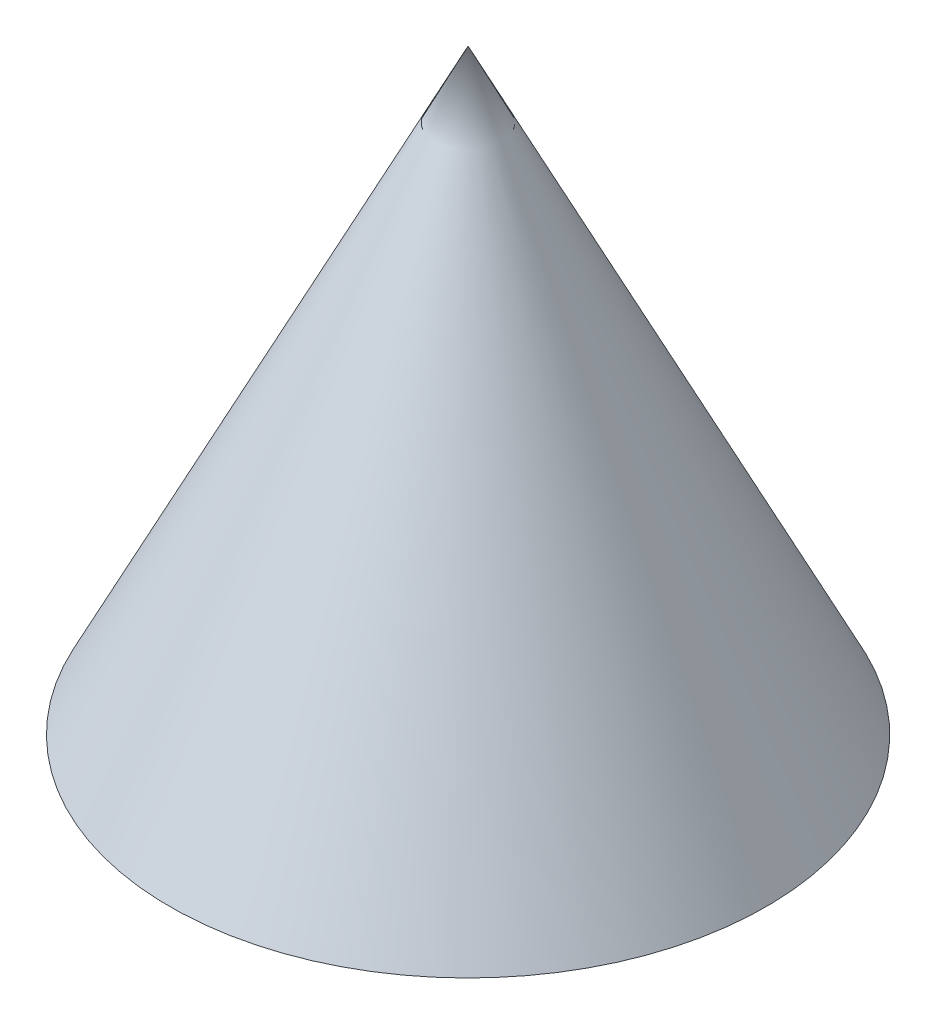
from build123d import *


with BuildPart() as part:
    # Sketch1 → Revolve1 (revolve)
    with BuildSketch(Plane.XY, mode=Mode.PRIVATE) as revolve1_sk:
        Polygon((0, 0), (0, 254), (127, 0), align=None)
    revolve(revolve1_sk.sketch.rotate(Axis((0, 0, 0), (0, 1, 0)), 90), axis=Axis((0, 0, 0), (0, 1, 0)))


solid = part.part
